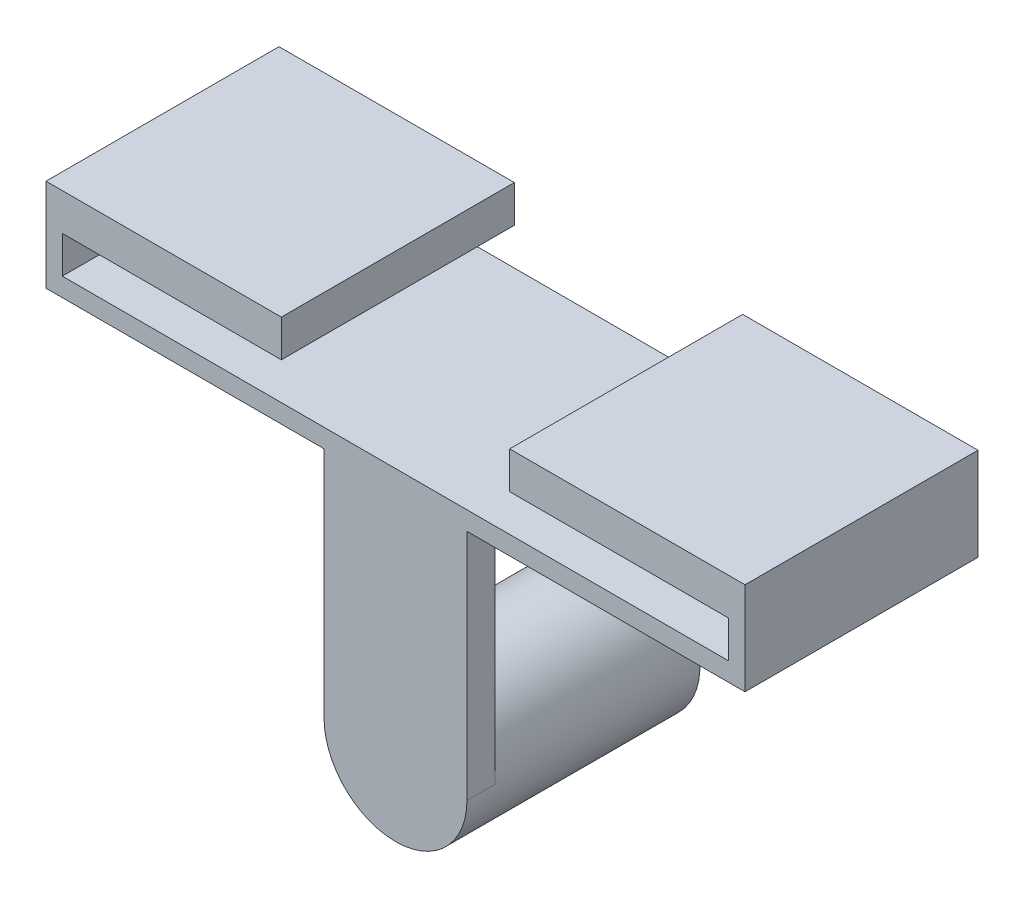
from build123d import *

# Parameters (mm, degrees)
BOSS_EXTRUDE1_DEPTH = 25.4
SKETCH2_W           = 7.790615149
SKETCH2_H           = 25.4
BOSS_EXTRUDE2_DEPTH = 3.048
SKETCH3_R           = 7.790615149
BOSS_EXTRUDE3_DEPTH = 25.4


with BuildPart() as part:
    # Sketch1 → Boss-Extrude1 (new body)
    with BuildSketch(Plane.XY):
        Polygon((-38.1, 0), (38.1, 0), (38.1, 10.1092), (12.442422535, 10.1092), (12.442422535, 6.0706), (36.322, 6.0706), (36.322, 2.032), (-36.322, 2.032), (-36.322, 6.0706), (-12.442422535, 6.0706), (-12.442422535, 10.1092), (-38.1, 10.1092), align=None)
    extrude(amount=-BOSS_EXTRUDE1_DEPTH)

    # Sketch2 → Boss-Extrude2 (add)
    with BuildSketch(Plane.XY):
        with Locations((-3.895307575, -12.7)):
            Rectangle(SKETCH2_W, SKETCH2_H)
        with Locations((3.895307575, -12.7)):
            Rectangle(SKETCH2_W, SKETCH2_H)
    extrude(amount=-BOSS_EXTRUDE2_DEPTH)

    # Sketch3 → Boss-Extrude3 (add)
    with BuildSketch(Plane(origin=(0, 0, 0), x_dir=(-1, 0, 0), z_dir=(0, 0, -1))):
        with Locations((0, -25.4)):
            Circle(SKETCH3_R)
    extrude(amount=BOSS_EXTRUDE3_DEPTH)


solid = part.part
